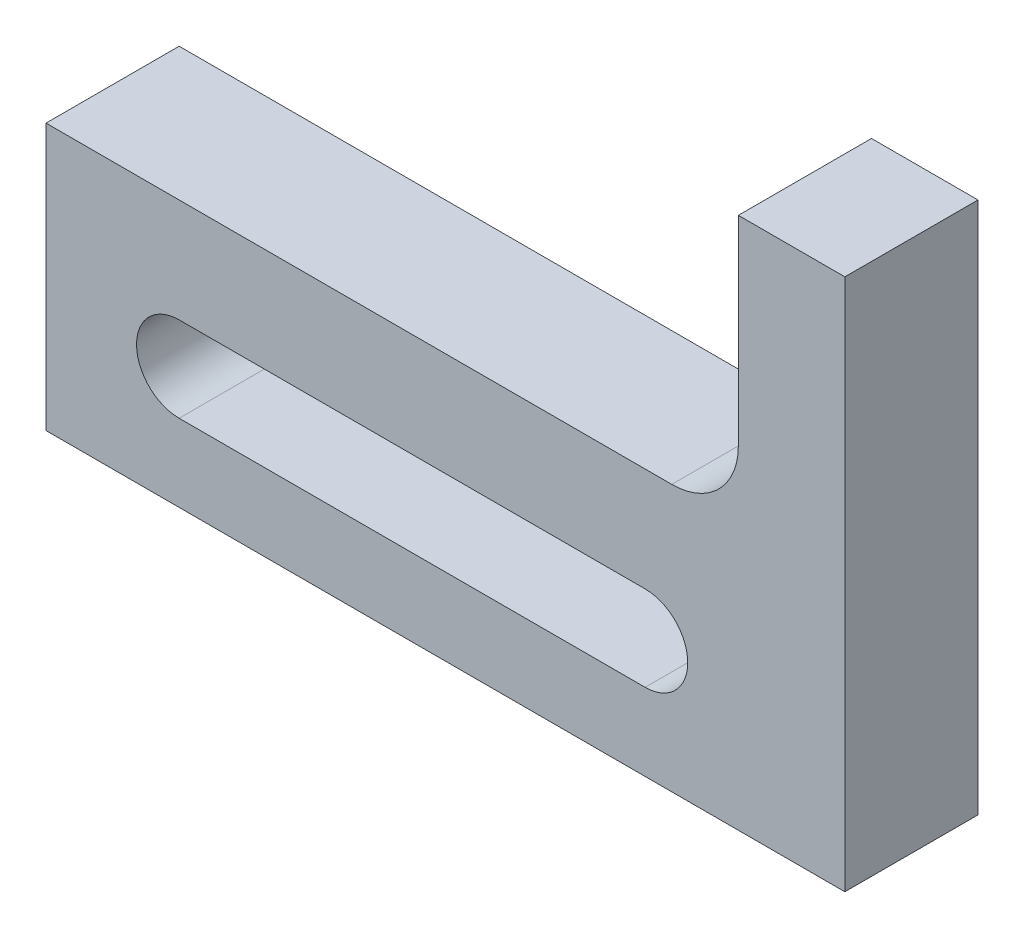
from build123d import *

# Parameters (mm, degrees)
SKETCH_1_W          = 60
SKETCH_1_H          = 40
EXTRUDE_1_DEPTH     = 10
SKETCH_2_W          = 52
SKETCH_2_H          = 20
CUT_EXTRUDE_1_DEPTH = 73.801098893
FILLET_1_R          = 5
CUT_EXTRUDE_2_DEPTH = 73.801098893


with BuildPart() as part:
    # 草图1 → 凸台-拉伸1 (new body)
    with BuildSketch(Plane.XY):
        with Locations((30, 20)):
            Rectangle(SKETCH_1_W, SKETCH_1_H)
    extrude(amount=EXTRUDE_1_DEPTH)

    # 草图2 → 切除-拉伸1 (cut, through all)
    with BuildSketch(Plane.XY.offset(10)):
        with Locations((26, 30)):
            Rectangle(SKETCH_2_W, SKETCH_2_H)
    extrude(amount=-CUT_EXTRUDE_1_DEPTH, mode=Mode.SUBTRACT)

    # 圆角1
    fillet_1_edges = [part.edges().sort_by_distance(p)[0] for p in [
        (52, 20, 5),
    ]]
    fillet(fillet_1_edges, radius=FILLET_1_R)

    # 草图3 → 切除-拉伸2 (cut, through all)
    with BuildSketch(Plane.XY.offset(10)):
        with BuildLine():
            Line((10, 12.2), (45, 12.2))
            ThreePointArc((45, 12.2), (48.2, 9), (45, 5.8))
            Line((45, 5.8), (10, 5.8))
            ThreePointArc((10, 5.8), (6.8, 9), (10, 12.2))
        make_face()
    extrude(amount=-CUT_EXTRUDE_2_DEPTH, mode=Mode.SUBTRACT)


solid = part.part
